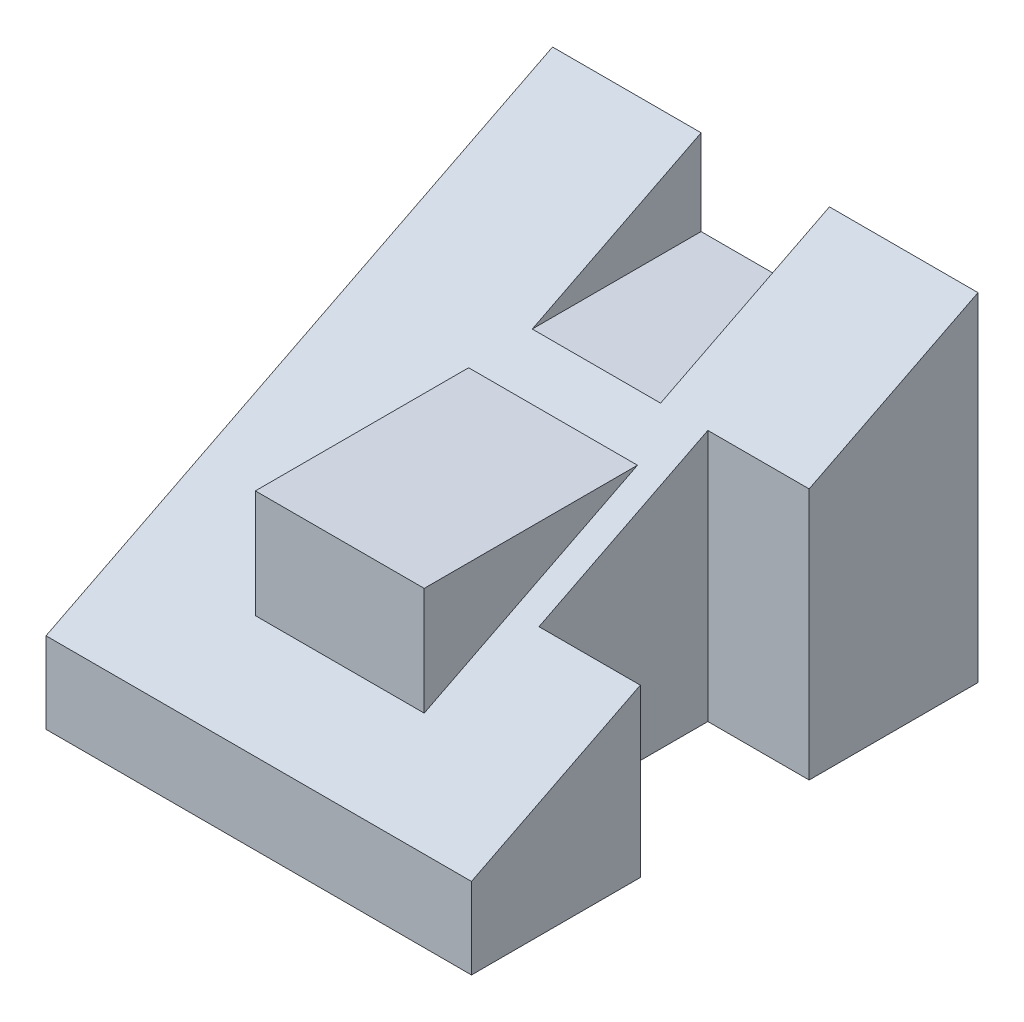
from build123d import *

# Parameters (mm, degrees)
BOSS_EXTRUDE1_DEPTH = 63
CUT_EXTRUDE1_DEPTH  = 15
BOSS_EXTRUDE2_DEPTH = 25
CUT_EXTRUDE2_DEPTH  = 19


with BuildPart() as part:
    # Sketch1 → Boss-Extrude1 (new body)
    with BuildSketch(Plane(origin=(0, 0, 0), x_dir=(0, 0, -1), z_dir=(1, 0, 0))):
        Polygon((75, 0), (75, 50), (0, 12), (0, 0), align=None)
    extrude(amount=-BOSS_EXTRUDE1_DEPTH)

    # Sketch2 → Cut-Extrude1 (cut)
    with BuildSketch(Plane(origin=(0, 0, 0), x_dir=(0, 0, -1), z_dir=(1, 0, 0))):
        Polygon((50, 0), (50, 37.333333333), (25, 24.666666667), (25, 0), align=None)
    extrude(amount=-CUT_EXTRUDE1_DEPTH, mode=Mode.SUBTRACT)

    # Sketch4 → Boss-Extrude2 (add)
    with BuildSketch(Plane(origin=(-19, 0, 0), x_dir=(0, 0, -1), z_dir=(1, 0, 0))):
        Polygon((12, 18.08), (12, 34.08), (43.578947368, 34.08), align=None)
    extrude(amount=-BOSS_EXTRUDE2_DEPTH)

    # Sketch5 → Cut-Extrude2 (cut)
    with BuildSketch(Plane(origin=(-22, 0, 0), x_dir=(0, 0, -1), z_dir=(1, 0, 0))):
        Polygon((75, 50), (50, 37.333333333), (75, 37.333333333), align=None)
    extrude(amount=-CUT_EXTRUDE2_DEPTH, mode=Mode.SUBTRACT)


solid = part.part
